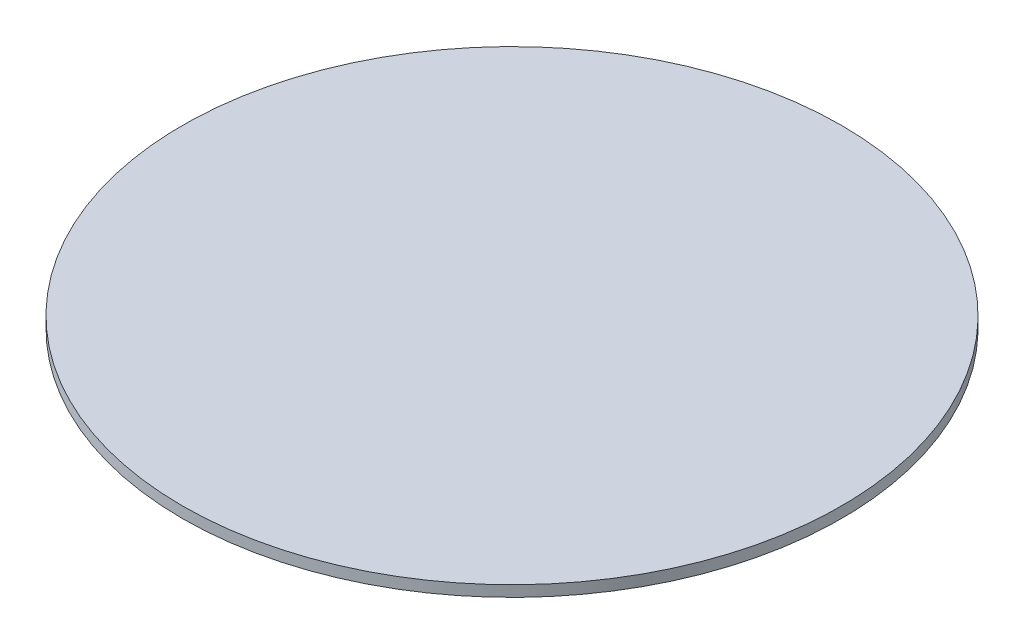
from build123d import *

# Parameters (mm, degrees)
SKETCH2_R           = 9
BOSS_EXTRUDE1_DEPTH = 0.3


with BuildPart() as part:
    # Sketch2 → Boss-Extrude1 (new body)
    with BuildSketch(Plane(origin=(0, 0, 0), x_dir=(1, 0, 0), z_dir=(0, 1, 0))):
        with Locations(Location((0, 0, 0), (0, 0, 270))):
            Circle(SKETCH2_R)
    extrude(amount=BOSS_EXTRUDE1_DEPTH)


solid = part.part
